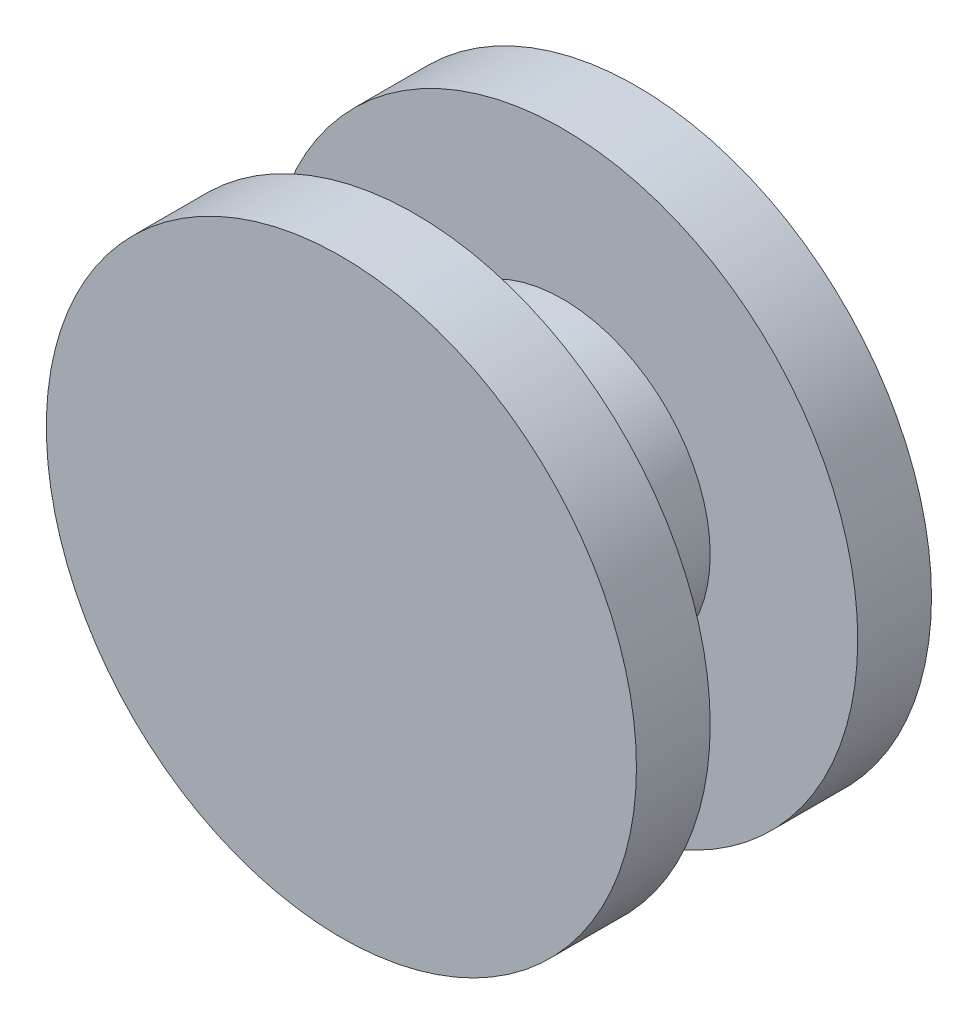
from build123d import *

# Parameters (mm, degrees)
SKETCH1_R           = 10
BOSS_EXTRUDE1_DEPTH = 10
SKETCH2_W           = 5
SKETCH2_H           = 5


with BuildPart() as part:
    # Sketch1 → Boss-Extrude1 (new body)
    with BuildSketch(Plane.XY):
        Circle(SKETCH1_R)
    extrude(amount=BOSS_EXTRUDE1_DEPTH)

    # Sketch2 → Cut-Revolve1 (revolve, cut)
    with BuildSketch(Plane(origin=(0, 0, 0), x_dir=(0, 0, -1), z_dir=(1, 0, 0)), mode=Mode.PRIVATE) as cut_revolve1_sk:
        with Locations((-5, 7.5)):
            Rectangle(SKETCH2_W, SKETCH2_H)
    revolve(cut_revolve1_sk.sketch.rotate(Axis((0, 0, 10), (0, 0, -1)), 90), axis=Axis((0, 0, 10), (0, 0, -1)), mode=Mode.SUBTRACT)


solid = part.part
